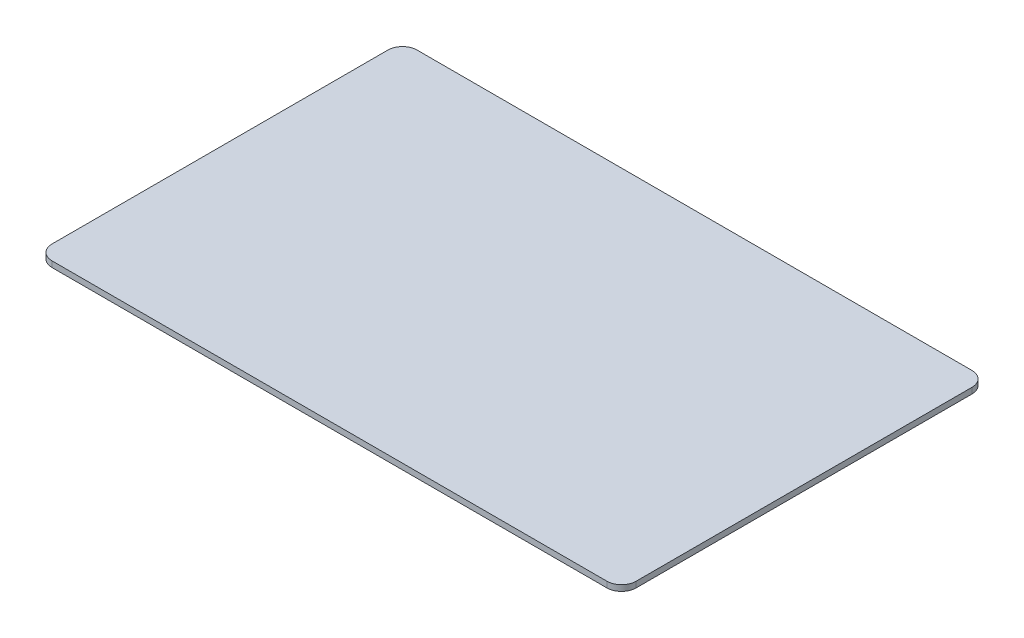
from build123d import *

# Parameters (mm, degrees)
AUFSATZ_LINEAR_AUSTRAGEN1_DEPTH = 1.6


with BuildPart() as part:
    # Skizze1 → Aufsatz-Linear austragen1 (new body)
    with BuildSketch(Plane(origin=(0, 0, 0), x_dir=(1, 0, 0), z_dir=(0, 1, 0))):
        with BuildLine():
            Line((4, 0), (156, 0))
            ThreePointArc((156, 0), (158.828427125, 1.171572875), (160, 4))
            Line((160, 4), (160, 96))
            ThreePointArc((160, 96), (158.828427125, 98.828427125), (156, 100))
            Line((156, 100), (4, 100))
            ThreePointArc((4, 100), (1.171572875, 98.828427125), (0, 96))
            Line((0, 96), (0, 4))
            ThreePointArc((0, 4), (1.171572875, 1.171572875), (4, 0))
        make_face()
    extrude(amount=AUFSATZ_LINEAR_AUSTRAGEN1_DEPTH)


solid = part.part
